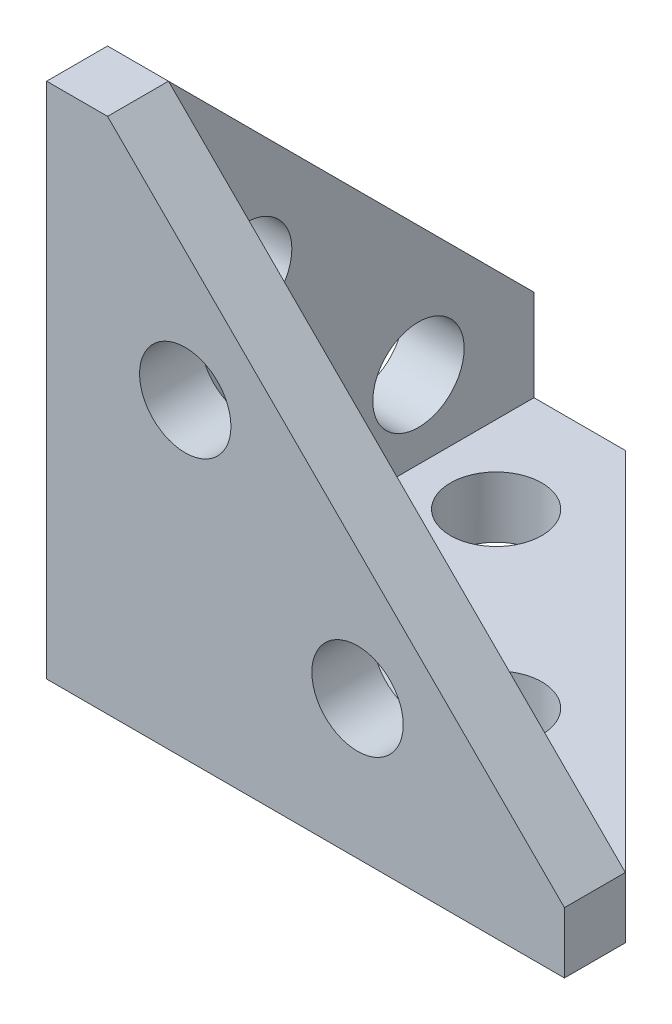
from build123d import *

# Parameters (mm, degrees)
BOSS_EXTRUDE1_DEPTH      = 2
BOSS_EXTRUDE2_DEPTH      = 15
BOSS_EXTRUDE2_DEPTH_BACK = 2
CUT_EXTRUDE1_DEPTH       = 15
CUT_EXTRUDE2_DEPTH       = 15
SKETCH5_R                = 1.5
CUT_EXTRUDE3_DEPTH       = 15
SKETCH6_R                = 1.5
CUT_EXTRUDE4_DEPTH       = 15
SKETCH7_R                = 1.5
CUT_EXTRUDE5_DEPTH       = 15
IZIM1_W                  = 17
IZIM1_H                  = 17
KES_EKSTR_ZYON1_DEPTH    = 3


with BuildPart() as part:
    # Sketch1 → Boss-Extrude1 (new body)
    with BuildSketch(Plane(origin=(0, 0, 0), x_dir=(1, 0, 0), z_dir=(0, 1, 0))):
        Polygon((0, 15), (15, 0), (0, 0), align=None)
    extrude(amount=BOSS_EXTRUDE1_DEPTH)

    # Sketch2 → Boss-Extrude2 (add, two sides: drawn at the far end of the back side and taken through both)
    with BuildSketch(Plane(origin=(0, 2, 0), x_dir=(1, 0, 0), z_dir=(0, 1, 0)).offset(-BOSS_EXTRUDE2_DEPTH_BACK)):
        Polygon((-2, -2), (15, -2), (15, 0), (0, 0), (0, 15), (-2, 15), align=None)
    extrude(amount=BOSS_EXTRUDE2_DEPTH + BOSS_EXTRUDE2_DEPTH_BACK)

    # Sketch3 → Cut-Extrude1 (cut)
    with BuildSketch(Plane(origin=(0, 0, 0), x_dir=(0, 0, -1), z_dir=(1, 0, 0))):
        Polygon((15, 2), (0, 17), (15, 17), align=None)
    extrude(amount=-CUT_EXTRUDE1_DEPTH, mode=Mode.SUBTRACT)

    # Sketch4 → Cut-Extrude2 (cut)
    with BuildSketch(Plane(origin=(0, 0, 0), x_dir=(-1, 0, 0), z_dir=(0, 0, -1))):
        Polygon((0, 17), (-15, 2), (-15, 17), align=None)
    extrude(amount=-CUT_EXTRUDE2_DEPTH, mode=Mode.SUBTRACT)

    # Sketch5 → Cut-Extrude3 (cut)
    with BuildSketch(Plane(origin=(0, 0, 0), x_dir=(0, 0, -1), z_dir=(1, 0, 0))):
        with Locations((2.550252532, 10.207106781)):
            Circle(SKETCH5_R)
        with Locations((8.207106781, 4.550252532)):
            Circle(SKETCH5_R)
    extrude(amount=-CUT_EXTRUDE3_DEPTH, mode=Mode.SUBTRACT)

    # Sketch6 → Cut-Extrude4 (cut)
    with BuildSketch(Plane(origin=(0, 0, 0), x_dir=(-1, 0, 0), z_dir=(0, 0, -1))):
        with Locations((-2.550252532, 10.207106781)):
            Circle(SKETCH6_R)
        with Locations((-8.207106781, 4.550252532)):
            Circle(SKETCH6_R)
    extrude(amount=-CUT_EXTRUDE4_DEPTH, mode=Mode.SUBTRACT)

    # Sketch7 → Cut-Extrude5 (cut)
    with BuildSketch(Plane(origin=(0, 2, 0), x_dir=(1, 0, 0), z_dir=(0, 1, 0))):
        with Locations(Location((2.550252532, 8.207106781, 0), (0, 0, 270))):
            Circle(SKETCH7_R)
        with Locations(Location((8.207106781, 2.550252532, 0), (0, 0, 270))):
            Circle(SKETCH7_R)
    extrude(amount=-CUT_EXTRUDE5_DEPTH, mode=Mode.SUBTRACT)

    # Çizim1 → Kes-Ekstrüzyon1 (cut)
    with BuildSketch(Plane(origin=(0, 0, -15), x_dir=(-1, 0, 0), z_dir=(0, 0, -1))):
        with Locations((-6.5, 8.5)):
            Rectangle(IZIM1_W, IZIM1_H)
    extrude(amount=-KES_EKSTR_ZYON1_DEPTH, mode=Mode.SUBTRACT)


solid = part.part
